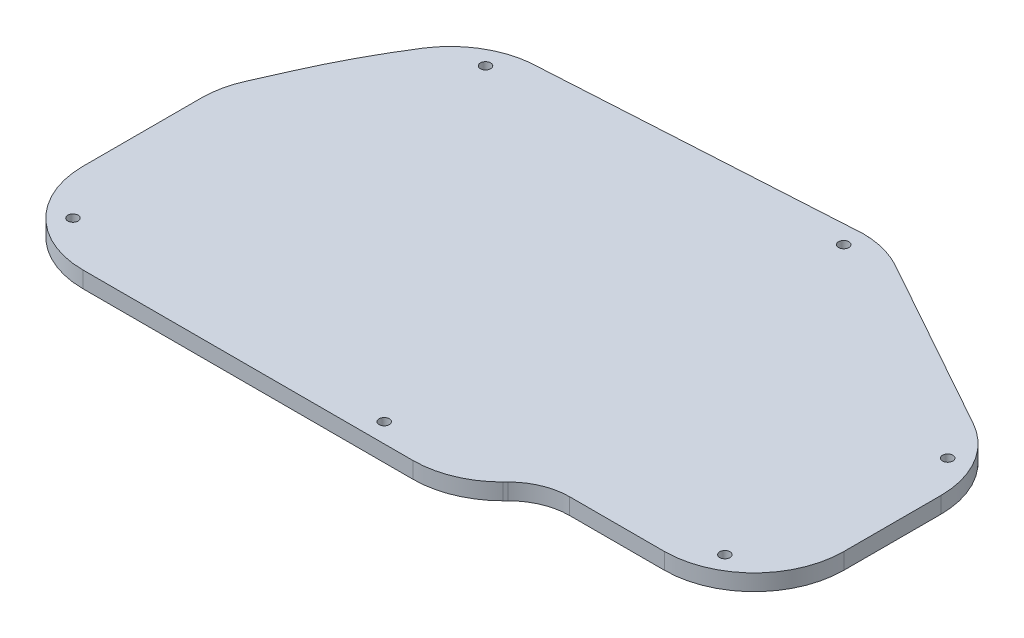
from build123d import *

# Parameters (mm, degrees)
SKETCH2_R           = 1
BOSS_EXTRUDE1_DEPTH = 3.175


with BuildPart() as part:
    # Sketch2 → Boss-Extrude1 (new body)
    with BuildSketch(Plane(origin=(0, 0, 0), x_dir=(1, 0, 0), z_dir=(0, 1, 0))):
        with BuildLine():
            Line((-257.8256366, -105.630010281), (-193.494425739, -105.630010281))
            ThreePointArc((-193.494425739, -105.630010281), (-186.797465673, -104.2979021), (-181.120057068, -100.504378951))
            Line((-181.120057068, -100.504378951), (-180.610104454, -99.994426337))
            ThreePointArc((-180.610104454, -99.994426337), (-176.717024269, -97.393153322), (-172.12482308, -96.479707712))
            Line((-172.12482308, -96.479707712), (-153.649556898, -96.479707712))
            ThreePointArc((-153.649556898, -96.479707712), (-141.275188227, -91.354076382), (-136.149556898, -78.979707712))
            Line((-136.149556898, -78.979707712), (-136.149556898, -60.08207123))
            ThreePointArc((-136.149556898, -60.08207123), (-138.561974219, -51.215569726), (-145.13411106, -44.793605572))
            Line((-145.13411106, -44.793605572), (-179.448460407, -25.681028163))
            ThreePointArc((-179.448460407, -25.681028163), (-183.56493756, -24.031398459), (-187.963906245, -23.469493821))
            Line((-187.963906245, -23.469493821), (-247.380541868, -26.968041449))
            ThreePointArc((-247.380541868, -26.968041449), (-255.809979804, -29.131986673), (-262.154750087, -35.088661324))
            ThreePointArc((-262.154750087, -35.088661324), (-266.895911353, -43.204457303), (-271.025140144, -51.648048015))
            Line((-271.025140144, -51.648048015), (-273.819629856, -57.941117122))
            ThreePointArc((-273.819629856, -57.941117122), (-274.944995262, -61.413292167), (-275.3256366, -65.043382939))
            Line((-275.3256366, -65.043382939), (-275.3256366, -88.130010281))
            ThreePointArc((-275.3256366, -88.130010281), (-270.200005271, -100.504378951), (-257.8256366, -105.630010281))
        make_face()
        with Locations(Location((-147.207602145, -91.127288498, 0), (0, 0, 270))):
            Circle(SKETCH2_R, mode=Mode.SUBTRACT)
        with Locations(Location((-141.795027651, -53.115534334, 0), (0, 0, 270))):
            Circle(SKETCH2_R, mode=Mode.SUBTRACT)
        with Locations(Location((-187.963906245, -27.219493821, 0), (0, 0, 270))):
            Circle(SKETCH2_R, mode=Mode.SUBTRACT)
        with Locations(Location((-253.051529835, -31.941972813, 0), (0, 0, 270))):
            Circle(SKETCH2_R, mode=Mode.SUBTRACT)
        with Locations(Location((-267.548354841, -97.852728522, 0), (0, 0, 270))):
            Circle(SKETCH2_R, mode=Mode.SUBTRACT)
        with Locations(Location((-202.85468144, -101.880010281, 0), (0, 0, 270))):
            Circle(SKETCH2_R, mode=Mode.SUBTRACT)
    extrude(amount=BOSS_EXTRUDE1_DEPTH)


solid = part.part
